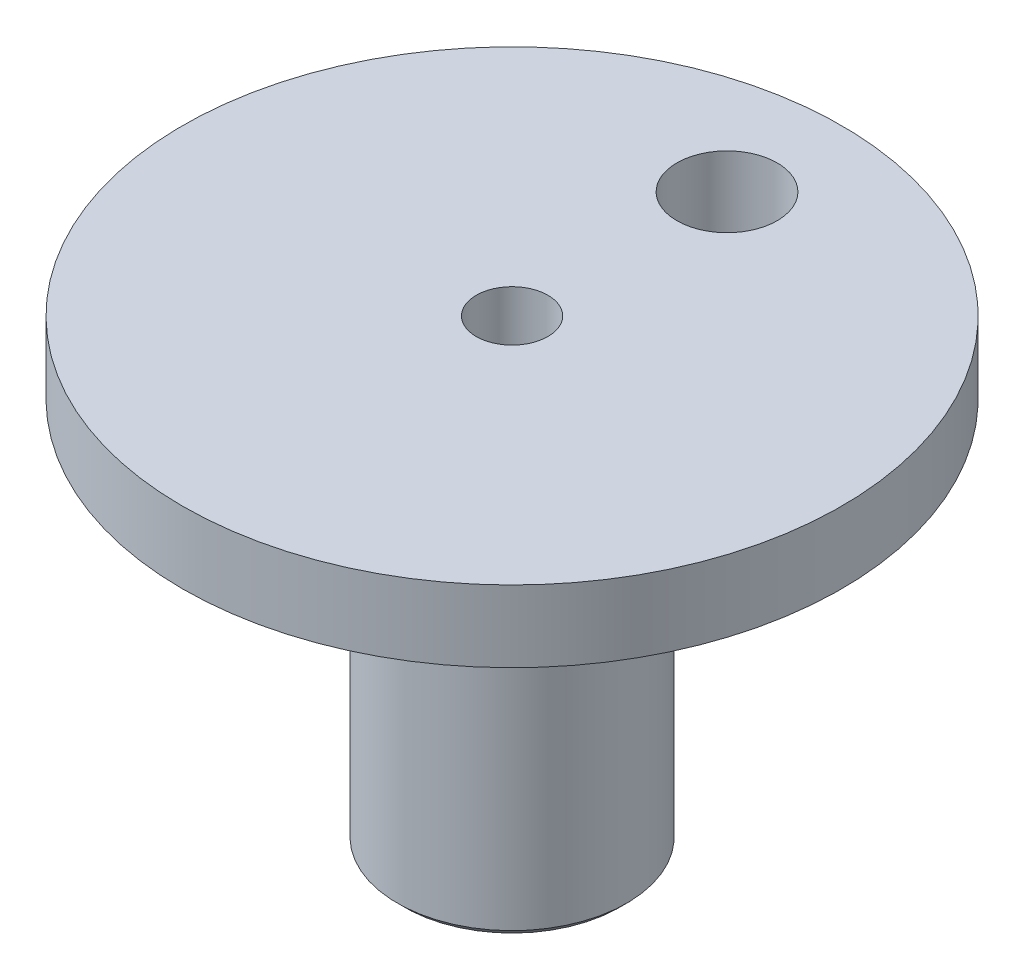
from build123d import *

# Parameters (mm, degrees)
SKETCH1_R           = 23
SKETCH1_R_2         = 3.5
BOSS_EXTRUDE1_DEPTH = 5
SKETCH2_R           = 8
BOSS_EXTRUDE2_DEPTH = 27
SKETCH3_R           = 2.5
CUT_EXTRUDE1_DEPTH  = 46.628938186
CHAMFER1_SIZE       = 0.5


with BuildPart() as part:
    # Sketch1 → Boss-Extrude1 (new body)
    with BuildSketch(Plane(origin=(0, 0, 0), x_dir=(1, 0, 0), z_dir=(0, 1, 0))):
        with Locations(Location((0, 0, 0), (0, 0, 270))):
            Circle(SKETCH1_R)
        with Locations(Location((0, 15, 0), (0, 0, 270))):
            Circle(SKETCH1_R_2, mode=Mode.SUBTRACT)
    extrude(amount=BOSS_EXTRUDE1_DEPTH)

    # Sketch2 → Boss-Extrude2 (add)
    with BuildSketch(Plane.XZ):
        with Locations(Location((0, 0, 0), (0, 0, 270))):
            Circle(SKETCH2_R)
    extrude(amount=BOSS_EXTRUDE2_DEPTH)

    # Sketch3 → Cut-Extrude1 (cut, through all)
    with BuildSketch(Plane(origin=(0, 5, 0), x_dir=(1, 0, 0), z_dir=(0, 1, 0))):
        with Locations(Location((0, 0, 0), (0, 0, 270))):
            Circle(SKETCH3_R)
    extrude(amount=-CUT_EXTRUDE1_DEPTH, mode=Mode.SUBTRACT)

    # Chamfer1
    chamfer1_edges = [part.edges().sort_by_distance(p)[0] for p in [
        (0, -27, 8),
    ]]
    chamfer(chamfer1_edges, length=CHAMFER1_SIZE)


solid = part.part
